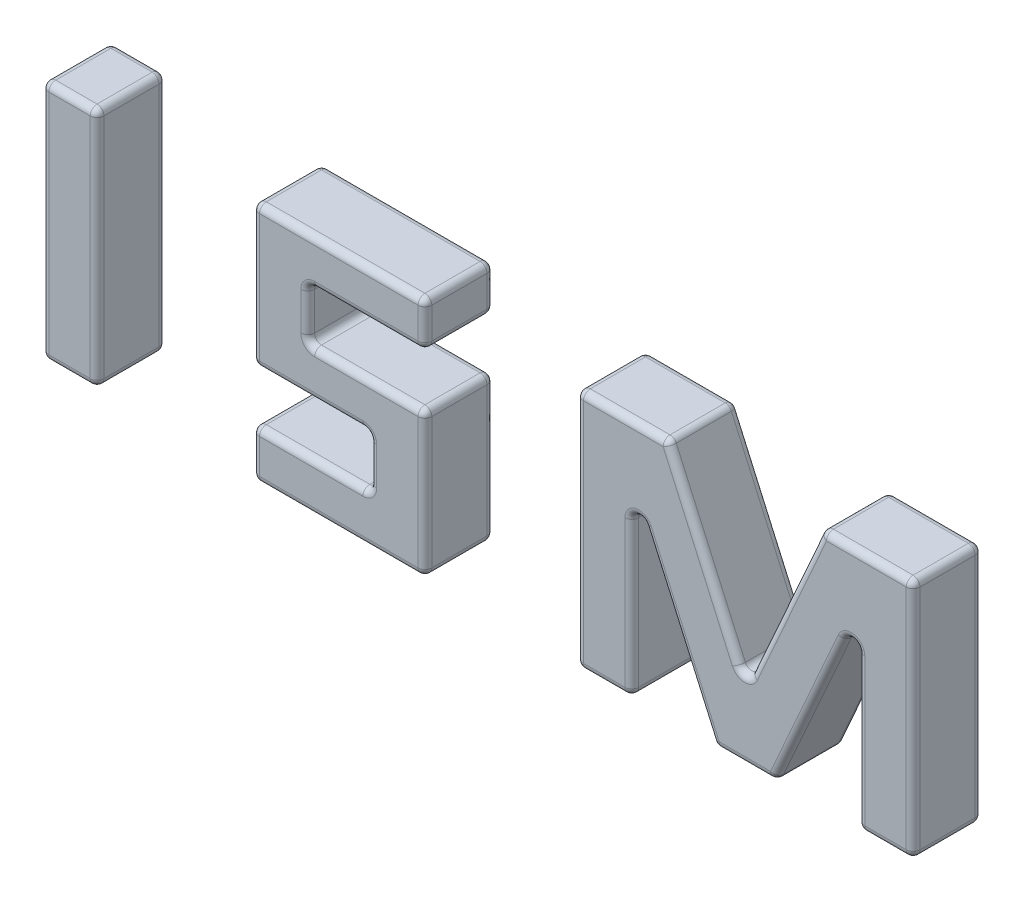
from build123d import *

# Parameters (mm, degrees)
SKETCH1_W             = 8
SKETCH1_H             = 35
BOSS_EXTRUDE1_DEPTH   = 10
BOSS_EXTRUDE1_2_DEPTH = 10
BOSS_EXTRUDE1_3_DEPTH = 10
FILLET1_R             = 1
FILLET2_R             = 1
FILLET3_R             = 1


with BuildPart() as part:
    # Sketch1 → Boss-Extrude1 (new body)
    with BuildSketch(Plane.XY):
        with Locations((4, 17.5)):
            Rectangle(SKETCH1_W, SKETCH1_H)
    extrude(amount=BOSS_EXTRUDE1_DEPTH)

    # Fillet1
    fillet1_edges = [part.edges().sort_by_distance(p)[0] for p in [
        (8, 17.5, 10),
        (4, 35, 10),
        (0, 17.5, 10),
        (4, 0, 10),
        (0, 17.5, 0),
        (4, 35, 0),
        (8, 17.5, 0),
        (4, 0, 0),
        (0, 0, 5),
        (0, 35, 5),
        (8, 35, 5),
        (8, 0, 5),
    ]]
    fillet(fillet1_edges, radius=FILLET1_R)


with BuildPart() as body_2:
    # Sketch1 → Boss-Extrude1 2 (new body)
    with BuildSketch(Plane.XY):
        Polygon((47.565044972, 7), (30.565044972, 7), (30.565044972, 0), (55.565044972, 0), (55.565044972, 21), (38.565044972, 21), (38.565044972, 28.5), (55.565044972, 28.5), (55.565044972, 35), (30.565044972, 35), (30.565044972, 14.5), (47.565044972, 14.5), align=None)
    extrude(amount=BOSS_EXTRUDE1_2_DEPTH)

    # Fillet2
    fillet2_edges = [body_2.edges().sort_by_distance(p)[0] for p in [
        (30.565044972, 3.5, 10),
        (47.565044972, 10.75, 0),
        (39.065044972, 14.5, 0),
        (30.565044972, 24.75, 0),
        (43.065044972, 0, 10),
        (43.065044972, 35, 0),
        (55.565044972, 31.75, 0),
        (47.065044972, 28.5, 0),
        (38.565044972, 24.75, 0),
        (47.065044972, 21, 0),
        (55.565044972, 10.5, 0),
        (43.065044972, 0, 0),
        (30.565044972, 3.5, 0),
        (39.065044972, 7, 0),
        (55.565044972, 10.5, 10),
        (47.565044972, 7, 5),
        (47.565044972, 14.5, 5),
        (30.565044972, 14.5, 5),
        (30.565044972, 35, 5),
        (55.565044972, 35, 5),
        (55.565044972, 28.5, 5),
        (38.565044972, 28.5, 5),
        (38.565044972, 21, 5),
        (55.565044972, 21, 5),
        (55.565044972, 0, 5),
        (30.565044972, 0, 5),
        (30.565044972, 7, 5),
        (47.065044972, 21, 10),
        (38.565044972, 24.75, 10),
        (47.065044972, 28.5, 10),
        (55.565044972, 31.75, 10),
        (43.065044972, 35, 10),
        (39.065044972, 7, 10),
        (30.565044972, 24.75, 10),
        (39.065044972, 14.5, 10),
        (47.565044972, 10.75, 10),
    ]]
    fillet(fillet2_edges, radius=FILLET2_R)


with BuildPart() as body_3:
    # Sketch1 → Boss-Extrude1 3 (new body)
    with BuildSketch(Plane.XY):
        Polygon((126.40077753, 35), (126.40077753, 0), (118.385634846, 0), (118.385634846, 27.006747045), (106.361456365, 0), (97.604366137, 0), (85.580187656, 27.006747045), (85.580187656, 0), (77.565044972, 0), (77.565044972, 35), (90.778452379, 35), (101.982911251, 9.834373342), (113.187370123, 35), align=None)
    extrude(amount=BOSS_EXTRUDE1_3_DEPTH)

    # Fillet3
    fillet3_edges = [body_3.edges().sort_by_distance(p)[0] for p in [
        (119.794073826, 35, 10),
        (122.393206188, 0, 0),
        (107.585140687, 22.417186671, 10),
        (118.385634846, 13.503373523, 0),
        (112.373545606, 13.503373523, 0),
        (101.982911251, 0, 0),
        (91.592276896, 13.503373523, 0),
        (85.580187656, 13.503373523, 0),
        (81.572616314, 0, 0),
        (77.565044972, 17.5, 0),
        (84.171748676, 35, 0),
        (96.380681815, 22.417186671, 0),
        (107.585140687, 22.417186671, 0),
        (96.380681815, 22.417186671, 10),
        (119.794073826, 35, 0),
        (126.40077753, 17.5, 0),
        (84.171748676, 35, 10),
        (126.40077753, 0, 5),
        (118.385634846, 0, 5),
        (118.385634846, 27.006747045, 5),
        (106.361456365, 0, 5),
        (97.604366137, 0, 5),
        (85.580187656, 27.006747045, 5),
        (85.580187656, 0, 5),
        (77.565044972, 0, 5),
        (77.565044972, 35, 5),
        (90.778452379, 35, 5),
        (101.982911251, 9.834373342, 5),
        (113.187370123, 35, 5),
        (126.40077753, 35, 5),
        (77.565044972, 17.5, 10),
        (81.572616314, 0, 10),
        (85.580187656, 13.503373523, 10),
        (91.592276896, 13.503373523, 10),
        (126.40077753, 17.5, 10),
        (101.982911251, 0, 10),
        (112.373545606, 13.503373523, 10),
        (118.385634846, 13.503373523, 10),
        (122.393206188, 0, 10),
    ]]
    fillet(fillet3_edges, radius=FILLET3_R)


solid = Compound([part.part, body_2.part, body_3.part])
